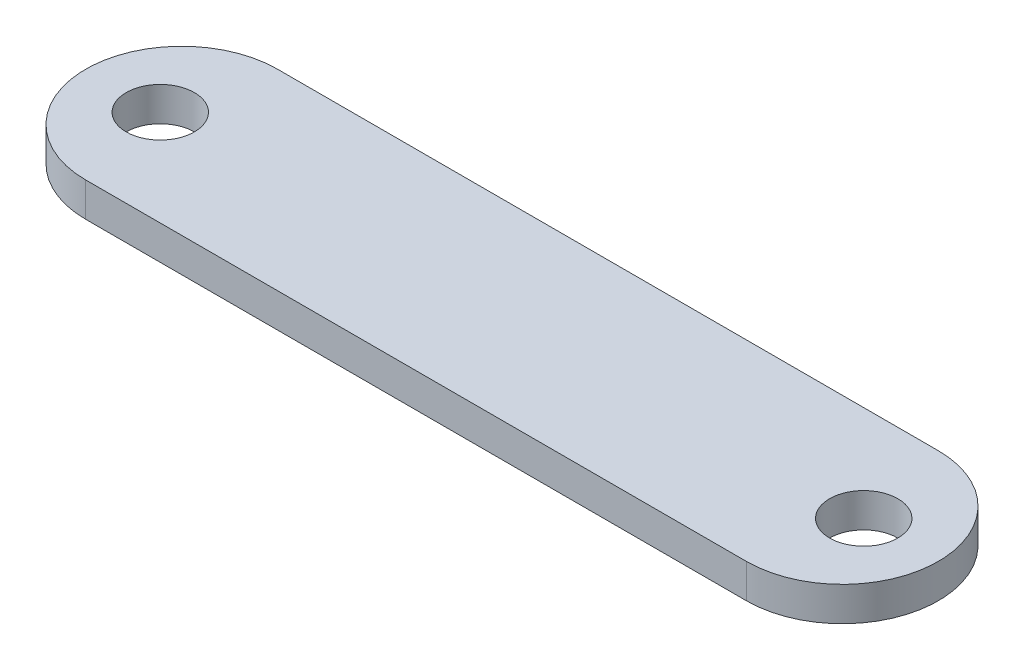
from build123d import *

# Parameters (mm, degrees)
SKETCH_1_R      = 1.6
EXTRUDE_1_DEPTH = 1.6


with BuildPart() as part:
    # 草图1 → 凸台-拉伸1 (new body)
    with BuildSketch(Plane(origin=(0, 0, 0), x_dir=(1, 0, 0), z_dir=(0, 1, 0))):
        with BuildLine():
            Line((-15.5, 4.5), (15.5, 4.5))
            ThreePointArc((15.5, 4.5), (20, 0), (15.5, -4.5))
            Line((15.5, -4.5), (-15.5, -4.5))
            ThreePointArc((-15.5, -4.5), (-20, 0), (-15.5, 4.5))
        make_face()
        with Locations(Location((-16.5, 0, 0), (0, 0, 270))):
            Circle(SKETCH_1_R, mode=Mode.SUBTRACT)
        with Locations(Location((16.5, 0, 0), (0, 0, 90))):
            Circle(SKETCH_1_R, mode=Mode.SUBTRACT)
    extrude(amount=EXTRUDE_1_DEPTH)


solid = part.part
